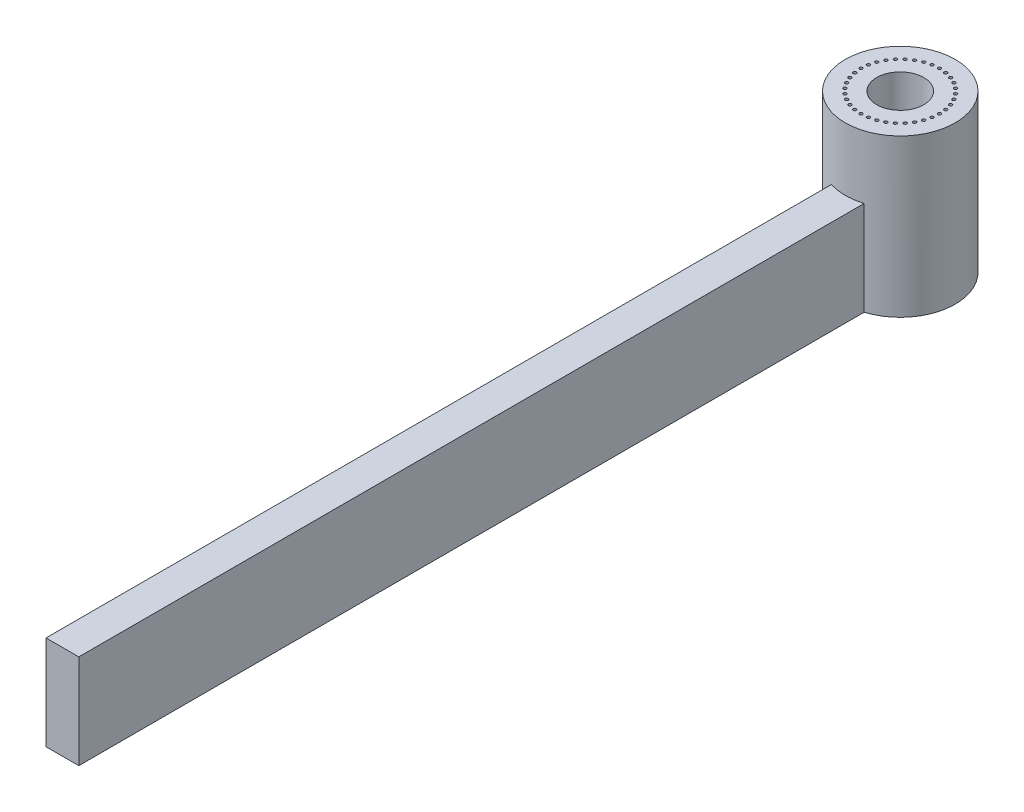
from build123d import *

# Parameters (mm, degrees)
SKETCH1_R           = 3.5
SKETCH1_R_2         = 0.1
SKETCH1_R_3         = 1.5
BOSS_EXTRUDE2_DEPTH = 10
SKETCH7_W           = 2.087565374
SKETCH7_H           = 50
BOSS_EXTRUDE4_DEPTH = 6


with BuildPart() as part:
    # Sketch1 → Boss-Extrude2 (new body)
    with BuildSketch(Plane(origin=(0, 0, 0), x_dir=(1, 0, 0), z_dir=(0, 1, 0))):
        with Locations(Location((0, 0, 0), (0, 0, 270))):
            Circle(SKETCH1_R)
        with Locations(Location((-1.606969024, 1.915111108, 0), (0, 0, 270))):
            Circle(SKETCH1_R_2, mode=Mode.SUBTRACT)
        with Locations(Location((-1.25, 2.165063509, 0), (0, 0, 270))):
            Circle(SKETCH1_R_2, mode=Mode.SUBTRACT)
        with Locations(Location((-0.855050358, 2.349231552, 0), (0, 0, 270))):
            Circle(SKETCH1_R_2, mode=Mode.SUBTRACT)
        with Locations(Location((-0.434120444, 2.462019383, 0), (0, 0, 270))):
            Circle(SKETCH1_R_2, mode=Mode.SUBTRACT)
        with Locations(Location((0, 2.5, 0), (0, 0, 270))):
            Circle(SKETCH1_R_2, mode=Mode.SUBTRACT)
        with Locations(Location((0.434120444, 2.462019383, 0), (0, 0, 270))):
            Circle(SKETCH1_R_2, mode=Mode.SUBTRACT)
        with Locations(Location((0.855050358, 2.349231552, 0), (0, 0, 270))):
            Circle(SKETCH1_R_2, mode=Mode.SUBTRACT)
        with Locations(Location((1.25, 2.165063509, 0), (0, 0, 270))):
            Circle(SKETCH1_R_2, mode=Mode.SUBTRACT)
        with Locations(Location((1.606969024, 1.915111108, 0), (0, 0, 270))):
            Circle(SKETCH1_R_2, mode=Mode.SUBTRACT)
        with Locations(Location((1.915111108, 1.606969024, 0), (0, 0, 270))):
            Circle(SKETCH1_R_2, mode=Mode.SUBTRACT)
        with Locations(Location((2.165063509, 1.25, 0), (0, 0, 270))):
            Circle(SKETCH1_R_2, mode=Mode.SUBTRACT)
        with Locations(Location((2.349231552, 0.855050358, 0), (0, 0, 270))):
            Circle(SKETCH1_R_2, mode=Mode.SUBTRACT)
        with Locations(Location((2.462019383, 0.434120444, 0), (0, 0, 270))):
            Circle(SKETCH1_R_2, mode=Mode.SUBTRACT)
        with Locations(Location((2.349231552, -0.855050358, 0), (0, 0, 270))):
            Circle(SKETCH1_R_2, mode=Mode.SUBTRACT)
        with Locations(Location((2.462019383, -0.434120444, 0), (0, 0, 270))):
            Circle(SKETCH1_R_2, mode=Mode.SUBTRACT)
        with Locations(Location((1.25, -2.165063509, 0), (0, 0, 270))):
            Circle(SKETCH1_R_2, mode=Mode.SUBTRACT)
        with Locations(Location((1.606969024, -1.915111108, 0), (0, 0, 270))):
            Circle(SKETCH1_R_2, mode=Mode.SUBTRACT)
        with Locations(Location((1.915111108, -1.606969024, 0), (0, 0, 270))):
            Circle(SKETCH1_R_2, mode=Mode.SUBTRACT)
        with Locations(Location((2.165063509, -1.25, 0), (0, 0, 270))):
            Circle(SKETCH1_R_2, mode=Mode.SUBTRACT)
        with Locations(Location((2.5, 0, 0), (0, 0, 270))):
            Circle(SKETCH1_R_2, mode=Mode.SUBTRACT)
        with Locations(Location((0.434120444, -2.462019383, 0), (0, 0, 270))):
            Circle(SKETCH1_R_2, mode=Mode.SUBTRACT)
        with Locations(Location((0.855050358, -2.349231552, 0), (0, 0, 270))):
            Circle(SKETCH1_R_2, mode=Mode.SUBTRACT)
        with Locations(Location((-0.434120444, -2.462019383, 0), (0, 0, 270))):
            Circle(SKETCH1_R_2, mode=Mode.SUBTRACT)
        with Locations(Location((-0.855050358, -2.349231552, 0), (0, 0, 270))):
            Circle(SKETCH1_R_2, mode=Mode.SUBTRACT)
        with Locations(Location((0, -2.5, 0), (0, 0, 270))):
            Circle(SKETCH1_R_2, mode=Mode.SUBTRACT)
        with Locations(Location((-1.25, -2.165063509, 0), (0, 0, 270))):
            Circle(SKETCH1_R_2, mode=Mode.SUBTRACT)
        with Locations(Location((-1.915111108, -1.606969024, 0), (0, 0, 270))):
            Circle(SKETCH1_R_2, mode=Mode.SUBTRACT)
        with Locations(Location((-1.606969024, -1.915111108, 0), (0, 0, 270))):
            Circle(SKETCH1_R_2, mode=Mode.SUBTRACT)
        with Locations(Location((-2.462019383, -0.434120444, 0), (0, 0, 270))):
            Circle(SKETCH1_R_2, mode=Mode.SUBTRACT)
        with Locations(Location((-2.349231552, -0.855050358, 0), (0, 0, 270))):
            Circle(SKETCH1_R_2, mode=Mode.SUBTRACT)
        with Locations(Location((-2.165063509, -1.25, 0), (0, 0, 270))):
            Circle(SKETCH1_R_2, mode=Mode.SUBTRACT)
        with Locations(Location((-2.349231552, 0.855050358, 0), (0, 0, 270))):
            Circle(SKETCH1_R_2, mode=Mode.SUBTRACT)
        with Locations(Location((-2.462019383, 0.434120444, 0), (0, 0, 270))):
            Circle(SKETCH1_R_2, mode=Mode.SUBTRACT)
        with Locations(Location((-2.5, 0, 0), (0, 0, 270))):
            Circle(SKETCH1_R_2, mode=Mode.SUBTRACT)
        with Locations(Location((-1.915111108, 1.606969024, 0), (0, 0, 270))):
            Circle(SKETCH1_R_2, mode=Mode.SUBTRACT)
        with Locations(Location((-2.165063509, 1.25, 0), (0, 0, 270))):
            Circle(SKETCH1_R_2, mode=Mode.SUBTRACT)
        with Locations(Location((0, 0, 0), (0, 0, 270))):
            Circle(SKETCH1_R_3, mode=Mode.SUBTRACT)
    extrude(amount=BOSS_EXTRUDE2_DEPTH)

    # Sketch7 → Boss-Extrude4 (add)
    with BuildSketch(Plane(origin=(0, 0, 0), x_dir=(1, 0, 0), z_dir=(0, 1, 0))):
        with Locations((0, -28.340736102)):
            Rectangle(SKETCH7_W, SKETCH7_H)
    extrude(amount=BOSS_EXTRUDE4_DEPTH)


solid = part.part
